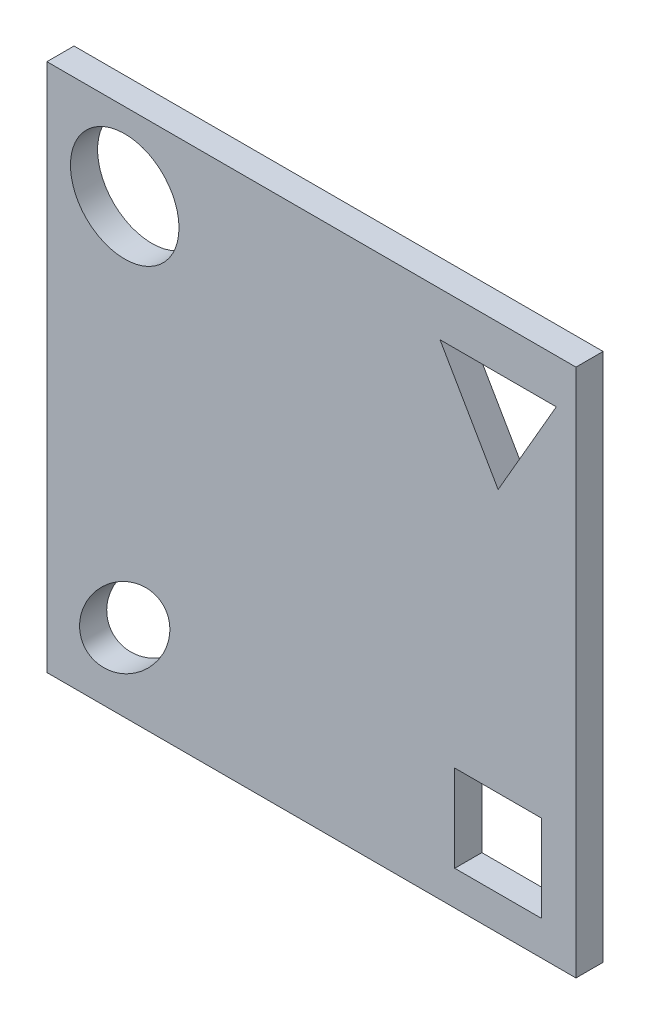
from build123d import *

# Parameters (mm, degrees)
SKETCH1_W           = 195
SKETCH1_H           = 195
SKETCH1_R           = 20
SKETCH1_RX          = 20.136316196
SKETCH1_RY          = 12.177676937
SKETCH1_W_2         = 32.002781641
SKETCH1_H_2         = 32.002781641
BOSS_EXTRUDE1_DEPTH = 10


with BuildPart() as part:
    # Sketch1 → Boss-Extrude1 (new body)
    with BuildSketch(Plane.XY):
        Rectangle(SKETCH1_W, SKETCH1_H)
        with Locations((-68.819541029, 68.819541029)):
            Circle(SKETCH1_R, mode=Mode.SUBTRACT)
        with Locations(Location((-68.819541029, -68.819541029), (0, 0, 45))):
            Ellipse(SKETCH1_RX, SKETCH1_RY, mode=Mode.SUBTRACT)
        Polygon((68.819541029, 44.07162726), (90.251863044, 81.193497914), (47.387219014, 81.193497914), align=None, mode=Mode.SUBTRACT)
        with Locations((68.81954103, -68.81954103)):
            Rectangle(SKETCH1_W_2, SKETCH1_H_2, mode=Mode.SUBTRACT)
    extrude(amount=BOSS_EXTRUDE1_DEPTH)


solid = part.part
